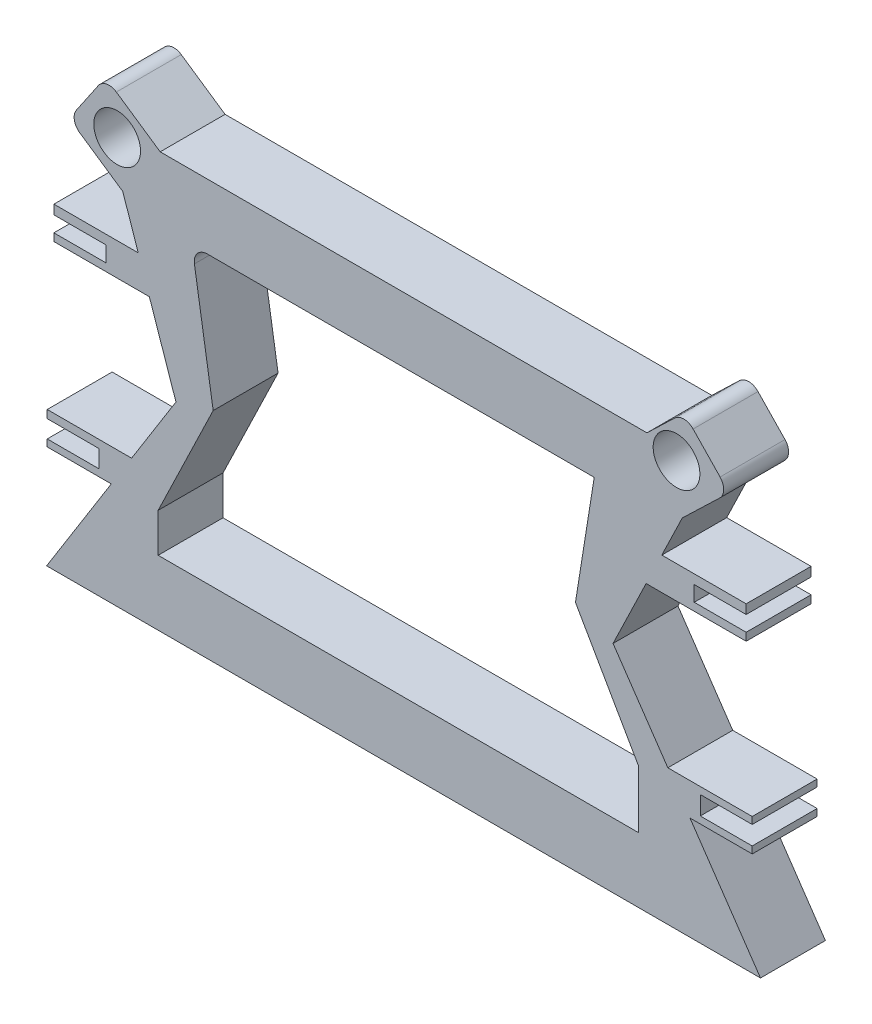
from build123d import *

# Parameters (mm, degrees)
BOSS_EXTRUDE1_DEPTH = 50
SKETCH2_R           = 18
CUT_EXTRUDE1_DEPTH  = 50
BOSS_EXTRUDE2_DEPTH = 50
SKETCH4_W           = 40
SKETCH4_H           = 12
SKETCH4_H_2         = 13.518900255
SKETCH4_H_3         = 14.308533634
SKETCH4_H_4         = 11.829037722
CUT_EXTRUDE2_DEPTH  = 50


with BuildPart() as part:
    # Sketch1 → Boss-Extrude1 (new body)
    with BuildSketch(Plane.XY):
        with BuildLine():
            Line((-24.526421899, 99.163181947), (350.473578101, 99.163181947))
            Line((350.473578101, 99.163181947), (371.914769804, 119.776399502))
            ThreePointArc((371.914769804, 119.776399502), (379.042121684, 122.565574817), (386.05416531, 119.49802075))
            Line((386.05416531, 119.49802075), (406.845690441, 97.871359363))
            ThreePointArc((406.845690441, 97.871359363), (409.634865756, 90.744007483), (406.567311689, 83.731963857))
            Line((406.567311689, 83.731963857), (377.731763174, 56.009930349))
            Line((377.731763174, 56.009930349), (324.38122579, -54.414567916))
            Line((324.38122579, -54.414567916), (437.973578101, -220.836818053))
            Line((437.973578101, -220.836818053), (-112.026421899, -220.836818053))
            Line((-112.026421899, -220.836818053), (-12.371310843, -61.686567499))
            Line((-12.371310843, -61.686567499), (-53.371269125, 58.313432501))
            Line((-53.371269125, 58.313432501), (-86.435025525, 80.825385165))
            ThreePointArc((-86.435025525, 80.825385165), (-90.631527546, 87.226011271), (-89.072976459, 94.719312431))
            Line((-89.072976459, 94.719312431), (-72.189011961, 119.517129731))
            ThreePointArc((-72.189011961, 119.517129731), (-65.788385855, 123.713631752), (-58.295084695, 122.155080665))
            Line((-58.295084695, 122.155080665), (-24.526421899, 99.163181947))
        make_face()
        with BuildLine():
            Line((11.720938897, 49.163181947), (309.883964405, 49.163181947))
            Line((309.883964405, 49.163181947), (295.427890661, -41.493267931))
            Line((295.427890661, -41.493267931), (343.868993372, -126.082556787))
            Line((343.868993372, -126.082556787), (343.868993372, -170.836818053))
            Line((343.868993372, -170.836818053), (-26.103706827, -170.836818053))
            Line((-26.103706827, -170.836818053), (-26.103706827, -140.838487627))
            Line((-26.103706827, -140.838487627), (16.301775704, -53.067972804))
            Line((16.301775704, -53.067972804), (1.84570196, 37.588477074))
            ThreePointArc((1.84570196, 37.588477074), (4.113473855, 45.653673117), (11.720938897, 49.163181947))
        make_face(mode=Mode.SUBTRACT)
    extrude(amount=BOSS_EXTRUDE1_DEPTH)

    # Sketch2 → Cut-Extrude1 (cut)
    with BuildSketch(Plane.XY.offset(50)):
        with Locations((-57.673911362, 92.071701739)):
            Circle(SKETCH2_R)
        with Locations((373.28081392, 92.071701739)):
            Circle(SKETCH2_R)
    extrude(amount=-CUT_EXTRUDE1_DEPTH, mode=Mode.SUBTRACT)

    # Sketch3 → Boss-Extrude2 (add)
    with BuildSketch(Plane.XY.offset(50)):
        Polygon((-32.871289984, -1.686567499), (-41.412947959, 23.313432501), (-106.412947959, 23.313432501), (-106.412947959, -1.686567499), align=None)
        Polygon((-62.198866371, -141.261692776), (-46.54461658, -116.261692776), (-111.54461658, -116.261692776), (-111.54461658, -141.261692776), align=None)
        Polygon((426.934763793, 23.313432501), (361.934763793, 23.313432501), (349.856253539, -1.686567499), (426.934763793, -1.686567499), align=None)
        Polygon((431.595295067, -116.261692776), (366.595295067, -116.261692776), (383.659172075, -141.261692776), (431.595295067, -141.261692776), align=None)
    extrude(amount=-BOSS_EXTRUDE2_DEPTH)

    # Sketch4 → Cut-Extrude2 (cut)
    with BuildSketch(Plane.XY.offset(50)):
        with Locations((-86.412947959, 10.171668266)):
            Rectangle(SKETCH4_W, SKETCH4_H)
        with Locations((-91.54461658, -129.156509465)):
            Rectangle(SKETCH4_W, SKETCH4_H_2)
        with Locations((411.595295067, -128.761692776)):
            Rectangle(SKETCH4_W, SKETCH4_H_3)
        with Locations((406.934763793, 10.257149405)):
            Rectangle(SKETCH4_W, SKETCH4_H_4)
    extrude(amount=-CUT_EXTRUDE2_DEPTH, mode=Mode.SUBTRACT)


solid = part.part
